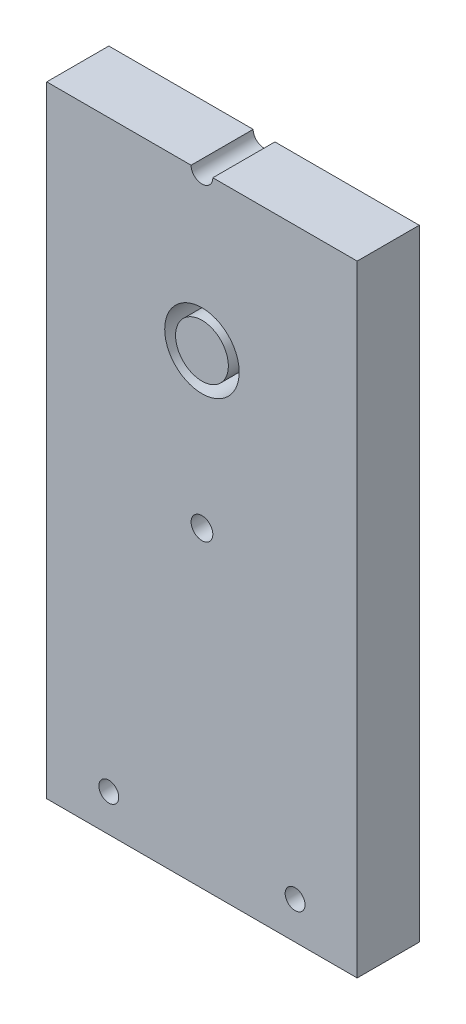
from build123d import *

# Parameters (mm, degrees)
SKETCH1_W           = 50
SKETCH1_H           = 100
BOSS_EXTRUDE1_DEPTH = 10
SKETCH2_R           = 1.6
SKETCH2_R_2         = 1.75
SKETCH2_R_3         = 6
SKETCH2_R_4         = 4.25
CUT_EXTRUDE2_DEPTH  = 11


with BuildPart() as part:
    # Sketch1 → Boss-Extrude1 (new body)
    with BuildSketch(Plane.XY):
        with Locations((0, 50)):
            Rectangle(SKETCH1_W, SKETCH1_H)
    extrude(amount=BOSS_EXTRUDE1_DEPTH)

    # Sketch2 → Cut-Extrude2 (cut)
    # profile 1 of 5: a face of its own
    with BuildSketch(Plane.XY):
        with Locations(Location((15, 6, 0), (0, 0, 180))):
            Circle(SKETCH2_R)
    # profile 2 of 5: a face of its own
    with BuildSketch(Plane.XY):
        with Locations(Location((-15, 6, 0), (0, 0, 180))):
            Circle(SKETCH2_R)
    # profile 3 of 5: a face of its own
    with BuildSketch(Plane.XY):
        with Locations((0, 100)):
            Circle(SKETCH2_R_2)
    # profile 4 of 5: a face of its own
    with BuildSketch(Plane.XY):
        with Locations(Location((0, 50.25, 0), (0, 0, 180))):
            Circle(SKETCH2_R_2)
    # profile 5 of 5: a face of its own
    with BuildSketch(Plane.XY):
        with Locations(Location((0, 75, 0), (0, 0, 180))):
            Circle(SKETCH2_R_3)
        with Locations(Location((0, 75, 0), (0, 0, 180))):
            Circle(SKETCH2_R_4, mode=Mode.SUBTRACT)
    extrude(amount=CUT_EXTRUDE2_DEPTH, mode=Mode.SUBTRACT)


with BuildPart() as cut_extrude2_piece_1:
    # of the separate pieces the step leaves, piece 1, a body of its own (cut_extrude2_pieces)
    add(part.part.solids().sort_by_distance((-25, 0, 0))[0])


with BuildPart() as cut_extrude2_piece_2:
    # of the separate pieces the step leaves, piece 2, a body of its own (cut_extrude2_pieces)
    add(part.part.solids().sort_by_distance((-4.25, 75, 0))[0])


solid = Compound([cut_extrude2_piece_1.part, cut_extrude2_piece_2.part])
